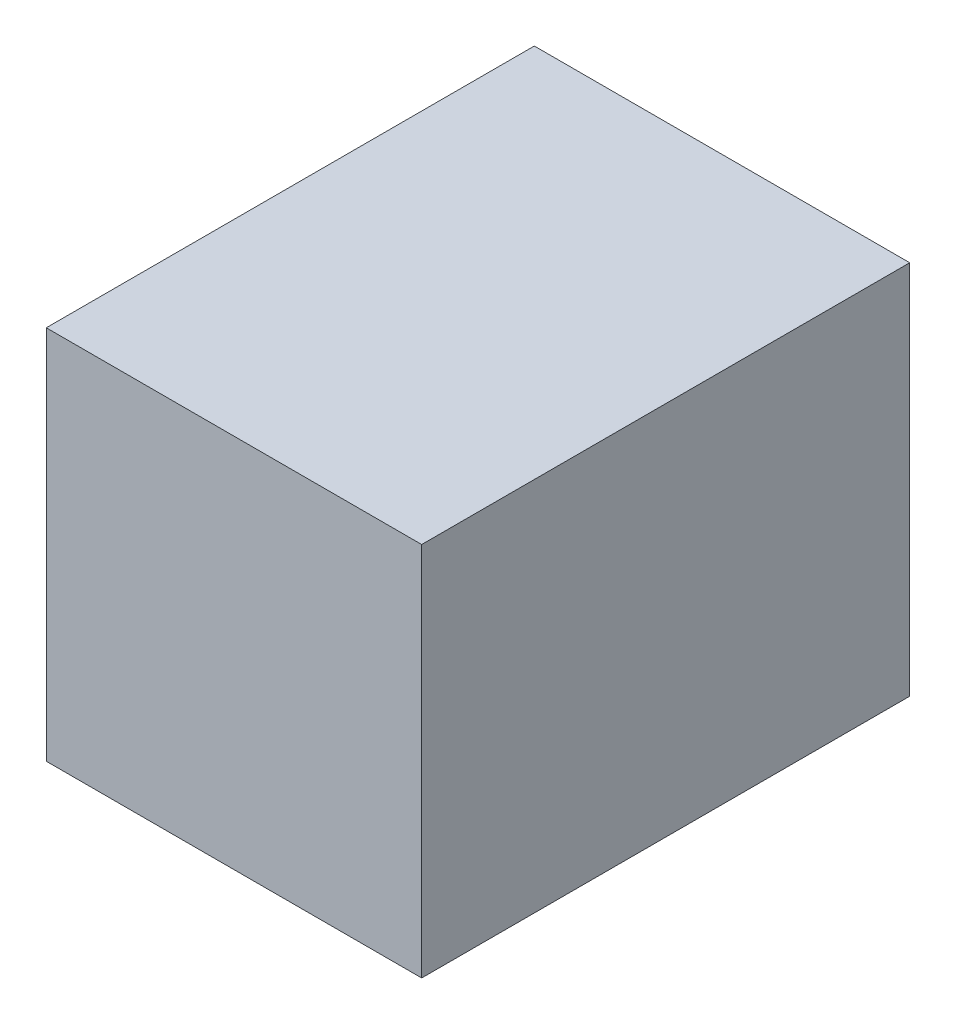
from build123d import *

# Parameters (mm, degrees)
EXTRUDE_1_DEPTH      = 10
EXTRUDE_1_DEPTH_BACK = 3
SKETCH_1_W           = 10
SKETCH_1_H           = 10


with BuildPart() as part:
    # 草图1 → 凸台-拉伸1 (new, two sides: drawn at the far end of the back side and taken through both)
    with BuildSketch(Plane.XY.offset(-EXTRUDE_1_DEPTH_BACK)):
        with Locations((5, 5)):
            Rectangle(SKETCH_1_W, SKETCH_1_H)
    extrude(amount=EXTRUDE_1_DEPTH + EXTRUDE_1_DEPTH_BACK)


solid = part.part
